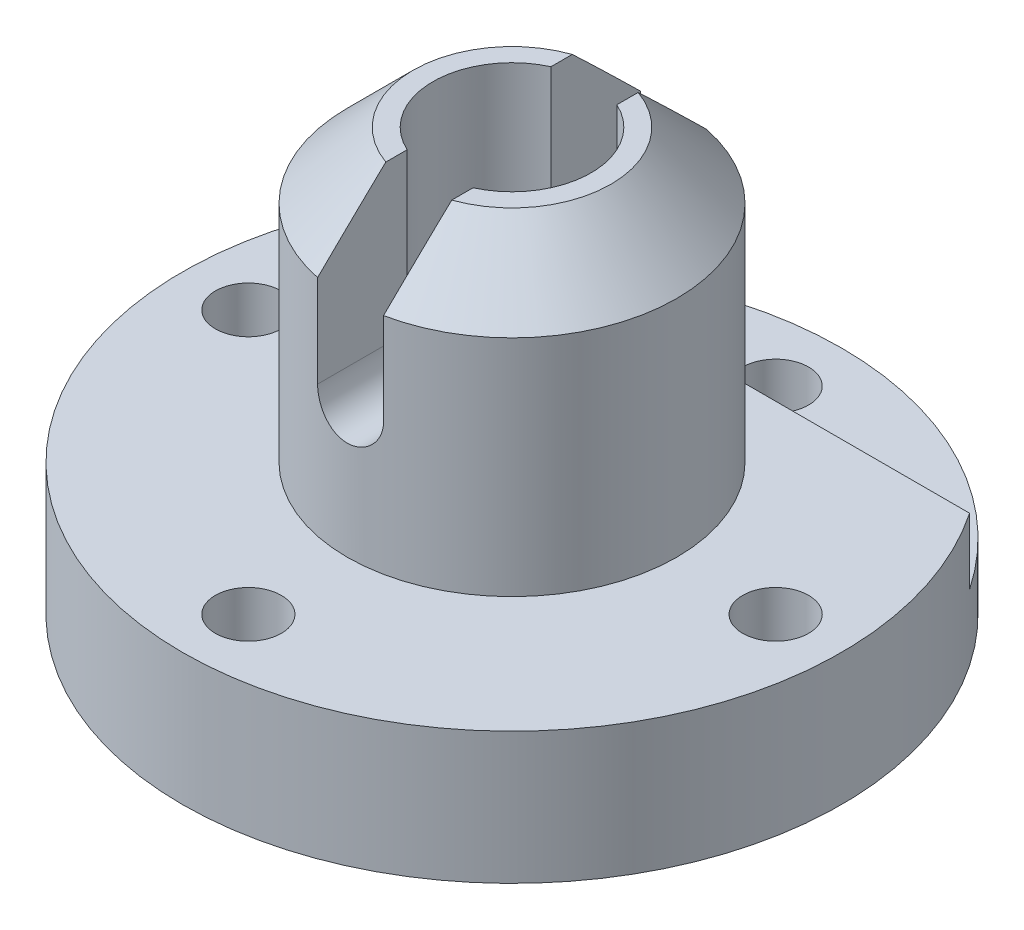
from build123d import *

# Parameters (mm, degrees)
SKETCH1_R               = 25
BOSS_EXTRUDE1_DEPTH     = 10
SKETCH1_3_R             = 12.5
SKETCH1_3_R_2           = 6
BOSS_EXTRUDE2_DEPTH     = 32
CUT_EXTRUDE1_START      = 5
CUT_EXTRUDE1_DEPTH      = 5
CUT_EXTRUDE2_DEPTH      = 48.68647607
CUT_EXTRUDE2_DEPTH_BACK = 48.68647607
SKETCH3_R               = 2.5
CUT_EXTRUDE3_DEPTH      = 48.686476137
CIRPATTERN1_COUNT       = 4
CHAMFER1_SIZE           = 5


with BuildPart() as part:
    # Sketch1 → Boss-Extrude1 (new body)
    with BuildSketch(Plane(origin=(0, 0, 0), x_dir=(1, 0, 0), z_dir=(0, 1, 0))):
        with Locations(Location((0, 0, 0), (0, 0, 270))):
            Circle(SKETCH1_R)
    extrude(amount=BOSS_EXTRUDE1_DEPTH)

    # Sketch1<3> → Boss-Extrude2 (add)
    with BuildSketch(Plane(origin=(0, 0, 0), x_dir=(1, 0, 0), z_dir=(0, 1, 0))):
        with Locations(Location((0, 0, 0), (0, 0, 270))):
            Circle(SKETCH1_3_R)
        with Locations(Location((0, 0, 0), (0, 0, 270))):
            Circle(SKETCH1_3_R_2, mode=Mode.SUBTRACT)
    extrude(amount=BOSS_EXTRUDE2_DEPTH)

    # Sketch1<5> → Cut-Extrude1 (cut)
    with BuildSketch(Plane(origin=(0, 0, 0), x_dir=(1, 0, 0), z_dir=(0, 1, 0)).offset(CUT_EXTRUDE1_START)):
        with BuildLine():
            ThreePointArc((20.712315177, 14), (0, 25), (-20.712315177, 14))
            Line((-20.712315177, 14), (20.712315177, 14))
        make_face()
    extrude(amount=CUT_EXTRUDE1_DEPTH, mode=Mode.SUBTRACT)

    # Sketch2 → Cut-Extrude2 (cut, two sides: drawn at the far end of the back side and taken through both)
    with BuildSketch(Plane.XY.offset(-CUT_EXTRUDE2_DEPTH_BACK)):
        with BuildLine():
            Line((0, 22.5), (0, 32))
            Line((0, 32), (-2.5, 32))
            Line((-2.5, 32), (-2.5, 20))
            ThreePointArc((-2.5, 20), (-1.767766953, 21.767766953), (0, 22.5))
        make_face()
        with BuildLine():
            Line((2.5, 32), (0, 32))
            Line((0, 32), (0, 22.5))
            ThreePointArc((0, 22.5), (1.767766953, 21.767766953), (2.5, 20))
            Line((2.5, 20), (2.5, 32))
        make_face()
        with BuildLine():
            ThreePointArc((2.5, 20), (1.767766953, 21.767766953), (0, 22.5))
            Line((0, 22.5), (0, 20))
            Line((0, 20), (2.5, 20))
        make_face()
        with BuildLine():
            Line((0, 20), (0, 22.5))
            ThreePointArc((0, 22.5), (-1.767766953, 21.767766953), (-2.5, 20))
            Line((-2.5, 20), (0, 20))
        make_face()
        with BuildLine():
            Line((2.5, 20), (0, 20))
            Line((0, 20), (0, 17.5))
            ThreePointArc((0, 17.5), (1.767766953, 18.232233047), (2.5, 20))
        make_face()
        with BuildLine():
            Line((0, 17.5), (0, 20))
            Line((0, 20), (-2.5, 20))
            ThreePointArc((-2.5, 20), (-1.767766953, 18.232233047), (0, 17.5))
        make_face()
    extrude(amount=CUT_EXTRUDE2_DEPTH + CUT_EXTRUDE2_DEPTH_BACK, mode=Mode.SUBTRACT)

    # Sketch3 → Cut-Extrude3 (cut, through all)
    with BuildSketch(Plane(origin=(0, 0, 0), x_dir=(1, 0, 0), z_dir=(0, 1, 0))):
        with Locations(Location((0, 20, 0), (0, 0, 270))):
            Circle(SKETCH3_R)
    cut_extrude3 = extrude(amount=CUT_EXTRUDE3_DEPTH, mode=Mode.SUBTRACT)

    # CirPattern1: Cut-Extrude3 ×4 about axis
    cirpattern1_axis = Axis((0, 0, 0), (0, 1, 0))
    for i in range(1, CIRPATTERN1_COUNT):
        add(cut_extrude3.rotate(cirpattern1_axis, i * 360 / CIRPATTERN1_COUNT), mode=Mode.SUBTRACT)

    # Chamfer1
    chamfer1_edges = [part.edges().sort_by_distance(p)[0] for p in [
        (-12.5, 32, 0),
        (12.5, 32, 0),
    ]]
    chamfer(chamfer1_edges, length=CHAMFER1_SIZE)


solid = part.part
